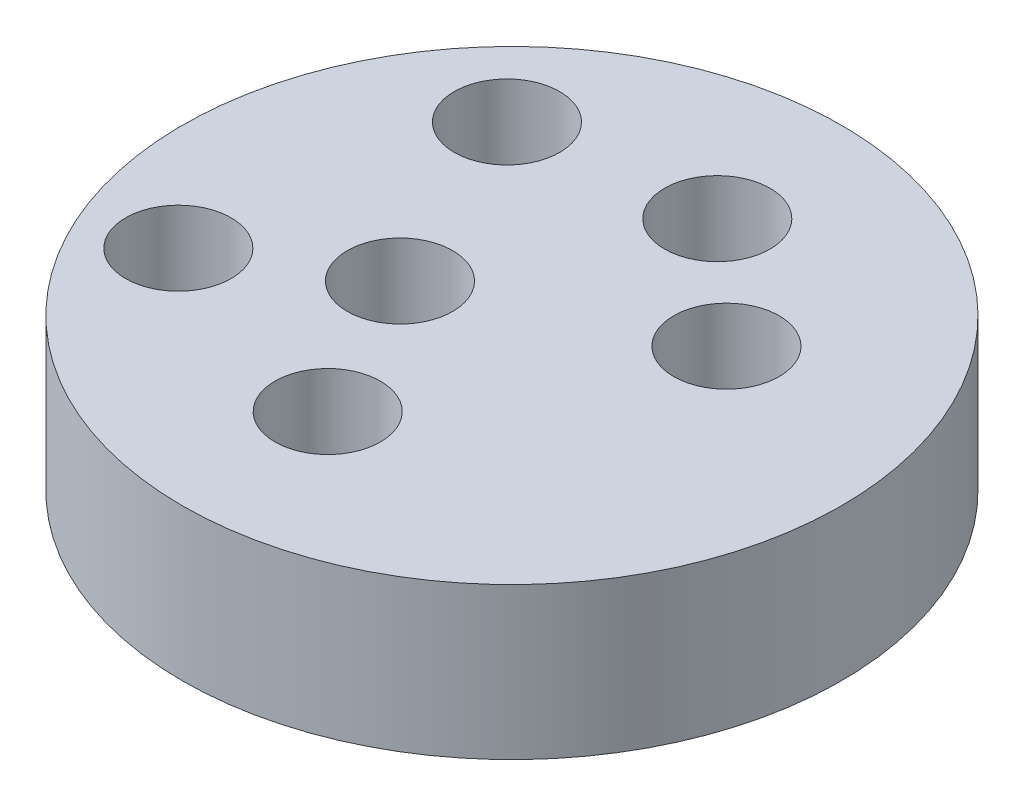
from build123d import *

# Parameters (mm, degrees)
SKETCH2_R              = 50
BOSS_EXTRUDE2_DEPTH    = 23
F_16_0MM_DOWEL_HOLE1_D = 16


with BuildPart() as part:
    # Sketch2 → Boss-Extrude2 (new body)
    with BuildSketch(Plane(origin=(0, 0, 0), x_dir=(1, 0, 0), z_dir=(0, 1, 0))):
        with Locations(Location((0, 0, 0), (0, 0, 270))):
            Circle(SKETCH2_R)
    extrude(amount=BOSS_EXTRUDE2_DEPTH)

    # Ø16.0mm Dowel Hole1 (through all)
    with Locations(Plane(origin=(0, 23, 0), x_dir=(1, 0, 0), z_dir=(0, 1, 0))):
        with Locations((-34.147330431, -16.460811011), (-25.804486223, 25.049949845), (-1.359027264, -26.593666798), (20.300455615, 12.243339794), (-13.022386315, -3.960976594), (2.852567021, 28.302601266)):
            Hole(F_16_0MM_DOWEL_HOLE1_D / 2)


solid = part.part
